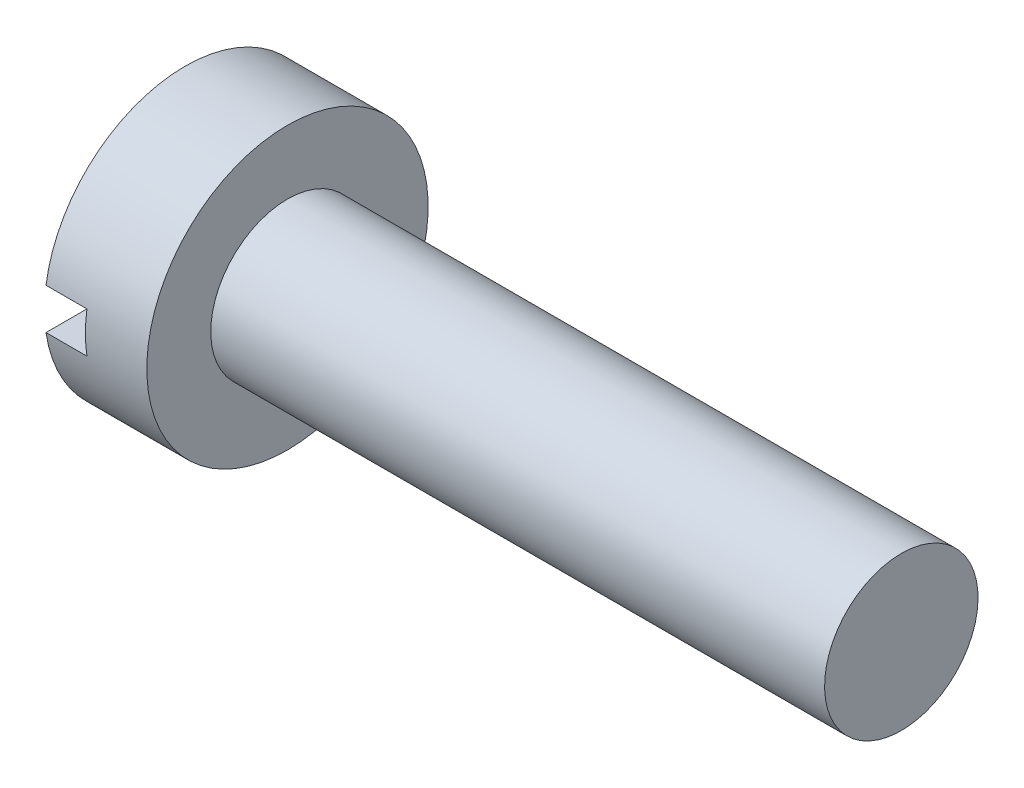
from build123d import *

# Parameters (mm, degrees)
SKETCH2_W          = 5.5
SKETCH2_H          = 0.8
CUT_EXTRUDE1_DEPTH = 0.8


with BuildPart() as part:
    # Sketch1 → Revolve1 (revolve)
    with BuildSketch(Plane.XY):
        Polygon((0, 0), (0, 2.75), (2, 2.75), (2, 1.5), (14, 1.5), (14, 0), align=None)
    revolve(axis=Axis((14, 0, 0), (-1, 0, 0)))

    # Sketch2 → Cut-Extrude1 (cut)
    with BuildSketch(Plane.ZY):
        Rectangle(SKETCH2_W, SKETCH2_H)
    extrude(amount=-CUT_EXTRUDE1_DEPTH, mode=Mode.SUBTRACT)


solid = part.part
